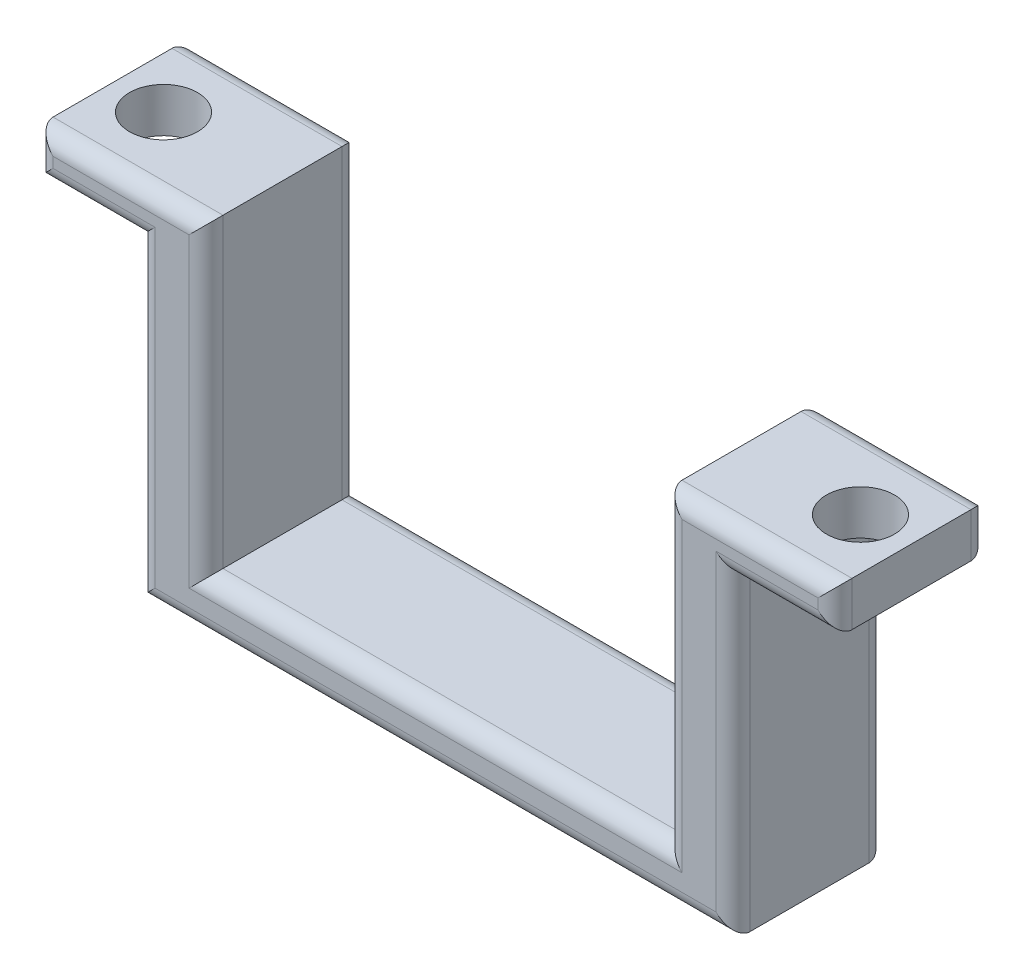
from build123d import *

# Parameters (mm, degrees)
BOSS_EXTRUDE1_DEPTH = 9
SKETCH2_R           = 2
CUT_EXTRUDE1_DEPTH  = 9
FILLET1_R           = 1


with BuildPart() as part:
    # Sketch1 → Boss-Extrude1 (new body)
    with BuildSketch(Plane.XY):
        Polygon((0, 0), (10, 0), (10, -18), (37, -18), (37, 0), (47, 0), (47, -2.614456703), (41, -2.614456703), (41, -21), (6, -21), (6, -2.614456703), (0, -2.614456703), align=None)
    extrude(amount=BOSS_EXTRUDE1_DEPTH)

    # Sketch2 → Cut-Extrude1 (cut)
    with BuildSketch(Plane.XZ.offset(2.614456703)):
        with Locations((3, 4.5)):
            Circle(SKETCH2_R)
    cut_extrude1 = extrude(amount=-CUT_EXTRUDE1_DEPTH, mode=Mode.SUBTRACT)

    # Mirror1: Cut-Extrude1 across plane
    add(cut_extrude1.mirror(Plane(origin=(23.5, 0, 0), x_dir=(0, 0, 1), z_dir=(1, 0, 0))), mode=Mode.SUBTRACT)

    # Fillet1
    fillet1_edges = [part.edges().sort_by_distance(p)[0] for p in [
        (5, 0, 0),
        (10, -9, 0),
        (6, -11.807228352, 9),
        (23.5, -18, 0),
        (37, -9, 0),
        (42, 0, 0),
        (47, -1.307228352, 0),
        (44, -2.614456703, 0),
        (41, -11.807228352, 0),
        (23.5, -21, 0),
        (6, -11.807228352, 0),
        (3, -2.614456703, 0),
        (0, -1.307228352, 0),
        (23.5, -21, 9),
        (41, -11.807228352, 9),
        (44, -2.614456703, 9),
        (47, -1.307228352, 9),
        (42, 0, 9),
        (37, -9, 9),
        (23.5, -18, 9),
        (10, -9, 9),
        (5, 0, 9),
        (0, -1.307228352, 9),
        (3, -2.614456703, 9),
    ]]
    fillet(fillet1_edges, radius=FILLET1_R)


solid = part.part
